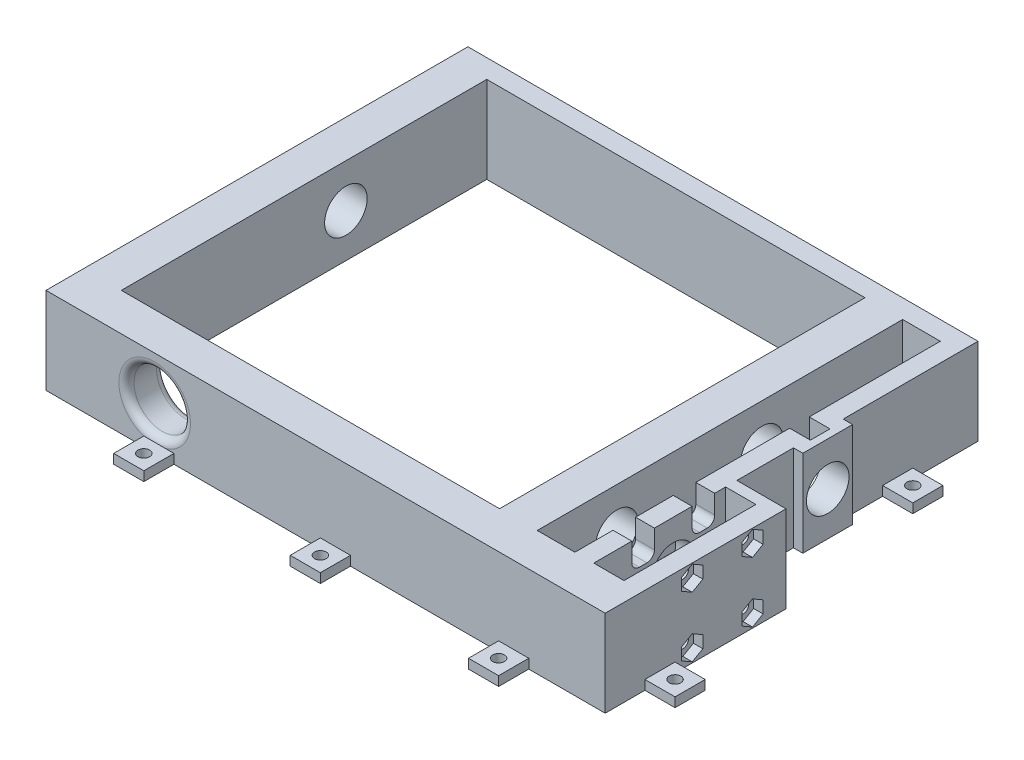
from build123d import *
from build123d.topology import SkipClean

# Parameters (mm, degrees)
SKETCH1_W              = 100.4
SKETCH1_H              = 97
SKETCH1_W_2            = 8.04
SKETCH1_H_2            = 35
SKETCH1_W_3            = 10
BOSS_EXTRUDE1_DEPTH    = 11.5
CUT_EXTRUDE1_REACH     = 135.92
SKETCH2_R              = 5.65
CUT_EXTRUDE2_REACH     = 135.92
SKETCH3_R              = 5.65
CUT_EXTRUDE5_START     = -5
SKETCH8_R              = 5.65
CUT_EXTRUDE5_DEPTH     = 5
SKETCH10_R             = 1.8
BOSS_EXTRUDE4_DEPTH    = 1
SKETCH11_R             = 1.5
CUT_EXTRUDE6_DEPTH     = 6
CUT_EXTRUDE7_DEPTH     = 2.5
CUT_EXTRUDE9_DEPTH     = 5
CUT_EXTRUDE10_REACH    = 144.978
SKETCH15_R             = 7.5
CUT_EXTRUDE11_DEPTH    = 10
FILLET1_R              = 2
SKETCH16_W             = 8
SKETCH16_H             = 8
SKETCH16_R             = 1.55
BOSS_EXTRUDE5_DEPTH    = 2.5
BOSS_EXTRUDE5_2_DEPTH  = 2.5
BOSS_EXTRUDE5_3_DEPTH  = 2.5
BOSS_EXTRUDE5_4_DEPTH  = 2.5
BOSS_EXTRUDE5_5_DEPTH  = 2.5
BOSS_EXTRUDE5_6_DEPTH  = 2.5
BOSS_EXTRUDE5_7_DEPTH  = 2.5
BOSS_EXTRUDE5_8_DEPTH  = 2.5
BOSS_EXTRUDE5_9_DEPTH  = 2.5
BOSS_EXTRUDE5_10_DEPTH = 2.5
SKETCH17_W             = 13.2
SKETCH17_H             = 23
SKETCH17_R             = 5.65
BOSS_EXTRUDE6_DEPTH    = 2.5
CUT_EXTRUDE12_DEPTH    = 0.5


with BuildPart() as part:
    # Sketch1 → Boss-Extrude1 (new, symmetric)
    with BuildSketch(Plane(origin=(0, 0, 0), x_dir=(1, 0, 0), z_dir=(0, 1, 0))):
        Polygon((-60.2, 54.5), (-60.2, -57.5), (88.24, -57.5), (88.24, -9.5), (75.2, -9.5), (75.2, 54.5), align=None)
        with Locations((0, 1)):
            Rectangle(SKETCH1_W, SKETCH1_H, mode=Mode.SUBTRACT)
        with Locations((79.22, -30)):
            Rectangle(SKETCH1_W_2, SKETCH1_H_2, mode=Mode.SUBTRACT)
        with Locations((65.2, 1)):
            Rectangle(SKETCH1_W_3, SKETCH1_H, mode=Mode.SUBTRACT)
    extrude(amount=BOSS_EXTRUDE1_DEPTH, both=True)

    # Cut-Extrude1: up to this face of the body (flat: up to its plane)
    cut_extrude1_end = Plane(part.part.faces().sort_by_distance((-60.2, 0, 1.5))[0])
    # Sketch2 → Cut-Extrude1 (cut, up to the picked face)
    with BuildSketch(Plane(origin=(60.2, 0, 0), x_dir=(0, 0, -1), z_dir=(1, 0, 0)), mode=Mode.PRIVATE) as cut_extrude1_sk1:
        with Locations((12.106, 0)):
            Circle(SKETCH2_R)
    cut_extrude1_tool1 = split(extrude(cut_extrude1_sk1.sketch, amount=-CUT_EXTRUDE1_REACH, mode=Mode.PRIVATE), bisect_by=cut_extrude1_end, keep=Keep.BOTH, mode=Mode.PRIVATE)
    add(cut_extrude1_tool1.solids().sort_by(Axis((60.2, 0, -12.106), (-1, 0, 0)))[0], mode=Mode.SUBTRACT)

    # Sketch3 → Cut-Extrude2 (cut, up to next)
    with BuildSketch(Plane(origin=(60.2, 0, 0), x_dir=(0, 0, -1), z_dir=(1, 0, 0)), mode=Mode.PRIVATE) as cut_extrude2_sk1:
        with Locations((-26.394, 0)):
            Circle(SKETCH3_R)
    cut_extrude2_tool1 = extrude(cut_extrude2_sk1.sketch, amount=-CUT_EXTRUDE2_REACH, mode=Mode.PRIVATE) & part.part
    add(cut_extrude2_tool1.solids().sort_by_distance((60.2, 0, 26.394))[0], mode=Mode.SUBTRACT)

    # Sketch8 → Cut-Extrude5 (cut)
    with BuildSketch(Plane.ZY.offset(-70.2).offset(CUT_EXTRUDE5_START)):
        with Locations(Location((26.394, 0, 0), (0, 0, 180))):
            Circle(SKETCH8_R)
    extrude(amount=CUT_EXTRUDE5_DEPTH, mode=Mode.SUBTRACT)

    # Sketch10 → Boss-Extrude4 (add)
    with BuildSketch(Plane.ZY.offset(-83.24)):
        with Locations((18.394, 8)):
            Circle(SKETCH10_R)
        with Locations((34.394, -8)):
            Circle(SKETCH10_R)
        with Locations((18.394, -8)):
            Circle(SKETCH10_R)
        with Locations((34.394, 8)):
            Circle(SKETCH10_R)
    extrude(amount=BOSS_EXTRUDE4_DEPTH)

    # Sketch11 → Cut-Extrude6 (cut)
    with BuildSketch(Plane.ZY.offset(-82.24)):
        with Locations((18.394, 8)):
            Circle(SKETCH11_R)
        with Locations((34.394, 8)):
            Circle(SKETCH11_R)
        with Locations((34.394, -8)):
            Circle(SKETCH11_R)
        with Locations((18.394, -8)):
            Circle(SKETCH11_R)
    extrude(amount=-CUT_EXTRUDE6_DEPTH, mode=Mode.SUBTRACT)

    # Sketch12 → Cut-Extrude7 (cut)
    with BuildSketch(Plane(origin=(88.24, 0, 0), x_dir=(0, 0, -1), z_dir=(1, 0, 0))):
        Polygon((-31.594, 9.616580754), (-34.394, 11.233161507), (-37.194, 9.616580754), (-37.194, 6.383419246), (-34.394, 4.766838493), (-31.594, 6.383419246), align=None)
        Polygon((-18.394, 11.233161507), (-21.194, 9.616580754), (-21.194, 6.383419246), (-18.394, 4.766838493), (-15.594, 6.383419246), (-15.594, 9.616580754), align=None)
        Polygon((-31.594, -6.383419246), (-34.394, -4.766838493), (-37.194, -6.383419246), (-37.194, -9.616580754), (-34.394, -11.233161507), (-31.594, -9.616580754), align=None)
        Polygon((-15.594, -6.383419246), (-18.394, -4.766838493), (-21.194, -6.383419246), (-21.194, -9.616580754), (-18.394, -11.233161507), (-15.594, -9.616580754), align=None)
    extrude(amount=-CUT_EXTRUDE7_DEPTH, mode=Mode.SUBTRACT)

    # Sketch13 → Cut-Extrude9 (cut)
    with BuildSketch(Plane(origin=(75.2, 0, 0), x_dir=(0, 0, -1), z_dir=(1, 0, 0))):
        with BuildLine():
            Line((-35.394, 4.5), (-33.394, 4.5))
            ThreePointArc((-33.394, 4.5), (-31.979786438, 5.085786438), (-31.394, 6.5))
            Line((-31.394, 6.5), (-31.394, 11.5))
            Line((-31.394, 11.5), (-37.394, 11.5))
            Line((-37.394, 11.5), (-37.394, 6.5))
            ThreePointArc((-37.394, 6.5), (-36.808213562, 5.085786438), (-35.394, 4.5))
        make_face()
        with BuildLine():
            Line((-19.394, 4.5), (-17.394, 4.5))
            ThreePointArc((-17.394, 4.5), (-15.979786438, 5.085786438), (-15.394, 6.5))
            Line((-15.394, 6.5), (-15.394, 11.5))
            Line((-15.394, 11.5), (-21.394, 11.5))
            Line((-21.394, 11.5), (-21.394, 6.5))
            ThreePointArc((-21.394, 6.5), (-20.808213562, 5.085786438), (-19.394, 4.5))
        make_face()
        with BuildLine():
            Line((-21.394, -11.5), (-15.394, -11.5))
            Line((-15.394, -11.5), (-15.394, -6.5))
            ThreePointArc((-15.394, -6.5), (-15.979786438, -5.085786438), (-17.394, -4.5))
            Line((-17.394, -4.5), (-19.394, -4.5))
            ThreePointArc((-19.394, -4.5), (-20.808213562, -5.085786438), (-21.394, -6.5))
            Line((-21.394, -6.5), (-21.394, -11.5))
        make_face()
        with BuildLine():
            Line((-37.394, -11.5), (-31.394, -11.5))
            Line((-31.394, -11.5), (-31.394, -6.5))
            ThreePointArc((-31.394, -6.5), (-31.979786438, -5.085786438), (-33.394, -4.5))
            Line((-33.394, -4.5), (-35.394, -4.5))
            ThreePointArc((-35.394, -4.5), (-36.808213562, -5.085786438), (-37.394, -6.5))
            Line((-37.394, -6.5), (-37.394, -11.5))
        make_face()
    extrude(amount=-CUT_EXTRUDE9_DEPTH, mode=Mode.SUBTRACT)

    # Sketch14 → Cut-Extrude10 (cut, up to next)
    with BuildSketch(Plane.ZY.offset(-70.2), mode=Mode.PRIVATE) as cut_extrude10_sk1:
        with BuildLine():
            ThreePointArc((-9.506, 5.016223679), (-12.106, 5.65), (-14.706, 5.016223679))
            Line((-14.706, 5.016223679), (-9.506, 5.016223679))
        make_face()
    cut_extrude10_tool1 = extrude(cut_extrude10_sk1.sketch, amount=-CUT_EXTRUDE10_REACH, mode=Mode.PRIVATE) & part.part
    # Sketch14 → Cut-Extrude10 (cut, up to next)
    with BuildSketch(Plane.ZY.offset(-70.2), mode=Mode.PRIVATE) as cut_extrude10_sk2:
        with BuildLine():
            Line((-9.506, 5.016223679), (-14.706, 5.016223679))
            ThreePointArc((-14.706, 5.016223679), (-15.041344954, -4.82765471), (-6.456, 0))
            ThreePointArc((-6.456, 0), (-7.27834529, 2.935344954), (-9.506, 5.016223679))
        make_face()
    cut_extrude10_tool2 = extrude(cut_extrude10_sk2.sketch, amount=-CUT_EXTRUDE10_REACH, mode=Mode.PRIVATE) & part.part
    # Sketch14 → Cut-Extrude10 (cut, up to next)
    with BuildSketch(Plane.ZY.offset(-70.2), mode=Mode.PRIVATE) as cut_extrude10_sk3:
        with BuildLine():
            Line((-14.706, 11.5), (-14.706, 5.016223679))
            ThreePointArc((-14.706, 5.016223679), (-12.106, 5.65), (-9.506, 5.016223679))
            Line((-9.506, 5.016223679), (-9.506, 11.5))
            Line((-9.506, 11.5), (-14.706, 11.5))
        make_face()
    cut_extrude10_tool3 = extrude(cut_extrude10_sk3.sketch, amount=-CUT_EXTRUDE10_REACH, mode=Mode.PRIVATE) & part.part
    # Sketch14 → Cut-Extrude10 (cut, up to next)
    with BuildSketch(Plane.ZY.offset(-70.2), mode=Mode.PRIVATE) as cut_extrude10_sk4:
        with BuildLine():
            ThreePointArc((-9.506, 5.016223679), (-12.106, 5.65), (-14.706, 5.016223679))
            Line((-14.706, 5.016223679), (-9.506, 5.016223679))
        make_face()
    cut_extrude10_tool4 = extrude(cut_extrude10_sk4.sketch, amount=-CUT_EXTRUDE10_REACH, mode=Mode.PRIVATE) & part.part
    # Sketch14 → Cut-Extrude10 (cut, up to next)
    with BuildSketch(Plane.ZY.offset(-70.2), mode=Mode.PRIVATE) as cut_extrude10_sk5:
        with BuildLine():
            Line((-9.506, 5.016223679), (-14.706, 5.016223679))
            ThreePointArc((-14.706, 5.016223679), (-15.041344954, -4.82765471), (-6.456, 0))
            ThreePointArc((-6.456, 0), (-7.27834529, 2.935344954), (-9.506, 5.016223679))
        make_face()
    cut_extrude10_tool5 = extrude(cut_extrude10_sk5.sketch, amount=-CUT_EXTRUDE10_REACH, mode=Mode.PRIVATE) & part.part
    add(cut_extrude10_tool1.solids().sort_by_distance((70.2, 5.270994, -12.106))[0], mode=Mode.SUBTRACT)
    add(cut_extrude10_tool2.solids().sort_by_distance((70.2, -0.119486, -12.106))[0], mode=Mode.SUBTRACT)
    add(cut_extrude10_tool3.solids().sort_by_distance((70.2, 8.468965, -12.106))[0], mode=Mode.SUBTRACT)
    add(cut_extrude10_tool4.solids().sort_by_distance((70.2, 5.270994, -12.106))[0], mode=Mode.SUBTRACT)
    add(cut_extrude10_tool5.solids().sort_by_distance((70.2, -0.119486, -12.106))[0], mode=Mode.SUBTRACT)

    # Sketch15 → Cut-Extrude11 (cut)
    with BuildSketch(Plane.XY.offset(57.5)):
        with Locations((-31.343663073, 0)):
            Circle(SKETCH15_R)
    extrude(amount=-CUT_EXTRUDE11_DEPTH, mode=Mode.SUBTRACT)

    # Fillet1
    fillet1_edges = [part.edges().sort_by_distance(p)[0] for p in [
        (-38.843663073, 0, 57.5),
        (-38.843663073, 0, 47.5),
    ]]
    fillet(fillet1_edges, radius=FILLET1_R)

    # Sketch17 → Boss-Extrude6 (add)
    with SkipClean():  # the faces are left unmerged after this step: merging them gives an invalid solid
        with BuildSketch(Plane(origin=(75.2, 0, 0), x_dir=(0, 0, -1), z_dir=(1, 0, 0))):
            with Locations((12.106, 0)):
                Rectangle(SKETCH17_W, SKETCH17_H)
            with Locations((12.106, 0)):
                Circle(SKETCH17_R, mode=Mode.SUBTRACT)
        extrude(amount=BOSS_EXTRUDE6_DEPTH)

    # Sketch18 → Cut-Extrude12 (cut)
    with SkipClean():  # the faces are left unmerged after this step: merging them gives an invalid solid
        with BuildSketch(Plane.ZY.offset(-75.2)):
            with BuildLine():
                Line((-9.506, 11.5), (-14.706, 11.5))
                Line((-14.706, 11.5), (-14.706, 5.016223679))
                ThreePointArc((-14.706, 5.016223679), (-12.106, 5.65), (-9.506, 5.016223679))
                Line((-9.506, 5.016223679), (-9.506, 11.5))
            make_face()
        extrude(amount=-CUT_EXTRUDE12_DEPTH, mode=Mode.SUBTRACT)


with BuildPart() as body_2:
    # Sketch16 → Boss-Extrude5 (new body)
    with BuildSketch(Plane.XZ.offset(11.5)):
        with Locations((-30.234989572, 61.5)):
            Rectangle(SKETCH16_W, SKETCH16_H)
        with Locations(Location((-30.234989572, 61.5, 0), (0, 0, 270))):
            Circle(SKETCH16_R, mode=Mode.SUBTRACT)
    extrude(amount=-BOSS_EXTRUDE5_DEPTH)


with BuildPart() as body_3:
    # Sketch16 → Boss-Extrude5 2 (new body)
    with BuildSketch(Plane.XZ.offset(11.5)):
        with Locations((-64.2, 40.100844613)):
            Rectangle(SKETCH16_W, SKETCH16_H)
        with Locations(Location((-64.2, 40.100844613, 0), (0, 0, 270))):
            Circle(SKETCH16_R, mode=Mode.SUBTRACT)
    extrude(amount=-BOSS_EXTRUDE5_2_DEPTH)


with BuildPart() as body_4:
    # Sketch16 → Boss-Extrude5 3 (new body)
    with BuildSketch(Plane.XZ.offset(11.5)):
        with Locations((-64.2, -40.582739237)):
            Rectangle(SKETCH16_W, SKETCH16_H)
        with Locations(Location((-64.2, -40.582739237, 0), (0, 0, 270))):
            Circle(SKETCH16_R, mode=Mode.SUBTRACT)
    extrude(amount=-BOSS_EXTRUDE5_3_DEPTH)


with BuildPart() as body_5:
    # Sketch16 → Boss-Extrude5 4 (new body)
    with BuildSketch(Plane.XZ.offset(11.5)):
        with Locations((-32.420266387, -58.5)):
            Rectangle(SKETCH16_W, SKETCH16_H)
        with Locations(Location((-32.420266387, -58.5, 0), (0, 0, 270))):
            Circle(SKETCH16_R, mode=Mode.SUBTRACT)
    extrude(amount=-BOSS_EXTRUDE5_4_DEPTH)


with BuildPart() as body_6:
    # Sketch16 → Boss-Extrude5 5 (new body)
    with BuildSketch(Plane.XZ.offset(11.5)):
        with Locations((-1.388118752, -58.5)):
            Rectangle(SKETCH16_W, SKETCH16_H)
        with Locations(Location((-1.388118752, -58.5, 0), (0, 0, 270))):
            Circle(SKETCH16_R, mode=Mode.SUBTRACT)
    extrude(amount=-BOSS_EXTRUDE5_5_DEPTH)


with BuildPart() as body_7:
    # Sketch16 → Boss-Extrude5 6 (new body)
    with BuildSketch(Plane.XZ.offset(11.5)):
        with Locations((50.82727414, -58.5)):
            Rectangle(SKETCH16_W, SKETCH16_H)
        with Locations(Location((50.82727414, -58.5, 0), (0, 0, 270))):
            Circle(SKETCH16_R, mode=Mode.SUBTRACT)
    extrude(amount=-BOSS_EXTRUDE5_6_DEPTH)


with BuildPart() as body_8:
    # Sketch16 → Boss-Extrude5 7 (new body)
    with BuildSketch(Plane.XZ.offset(11.5)):
        with Locations((79.2, -33.182434031)):
            Rectangle(SKETCH16_W, SKETCH16_H)
        with Locations(Location((79.2, -33.182434031, 0), (0, 0, 270))):
            Circle(SKETCH16_R, mode=Mode.SUBTRACT)
    extrude(amount=-BOSS_EXTRUDE5_7_DEPTH)


with BuildPart() as body_9:
    # Sketch16 → Boss-Extrude5 8 (new body)
    with BuildSketch(Plane.XZ.offset(11.5)):
        with Locations((92.24, 42.962096285)):
            Rectangle(SKETCH16_W, SKETCH16_H)
        with Locations(Location((92.24, 42.962096285, 0), (0, 0, 270))):
            Circle(SKETCH16_R, mode=Mode.SUBTRACT)
    extrude(amount=-BOSS_EXTRUDE5_8_DEPTH)


with BuildPart() as body_10:
    # Sketch16 → Boss-Extrude5 9 (new body)
    with BuildSketch(Plane.XZ.offset(11.5)):
        with Locations((63.947578499, 61.5)):
            Rectangle(SKETCH16_W, SKETCH16_H)
        with Locations(Location((63.947578499, 61.5, 0), (0, 0, 270))):
            Circle(SKETCH16_R, mode=Mode.SUBTRACT)
    extrude(amount=-BOSS_EXTRUDE5_9_DEPTH)


with BuildPart() as body_11:
    # Sketch16 → Boss-Extrude5 10 (new body)
    with BuildSketch(Plane.XZ.offset(11.5)):
        with Locations((16.623553356, 61.5)):
            Rectangle(SKETCH16_W, SKETCH16_H)
        with Locations(Location((16.623553356, 61.5, 0), (0, 0, 270))):
            Circle(SKETCH16_R, mode=Mode.SUBTRACT)
    extrude(amount=-BOSS_EXTRUDE5_10_DEPTH)


solid = Compound([part.part, body_2.part, body_3.part, body_4.part, body_5.part, body_6.part, body_7.part, body_8.part, body_9.part, body_10.part, body_11.part])
